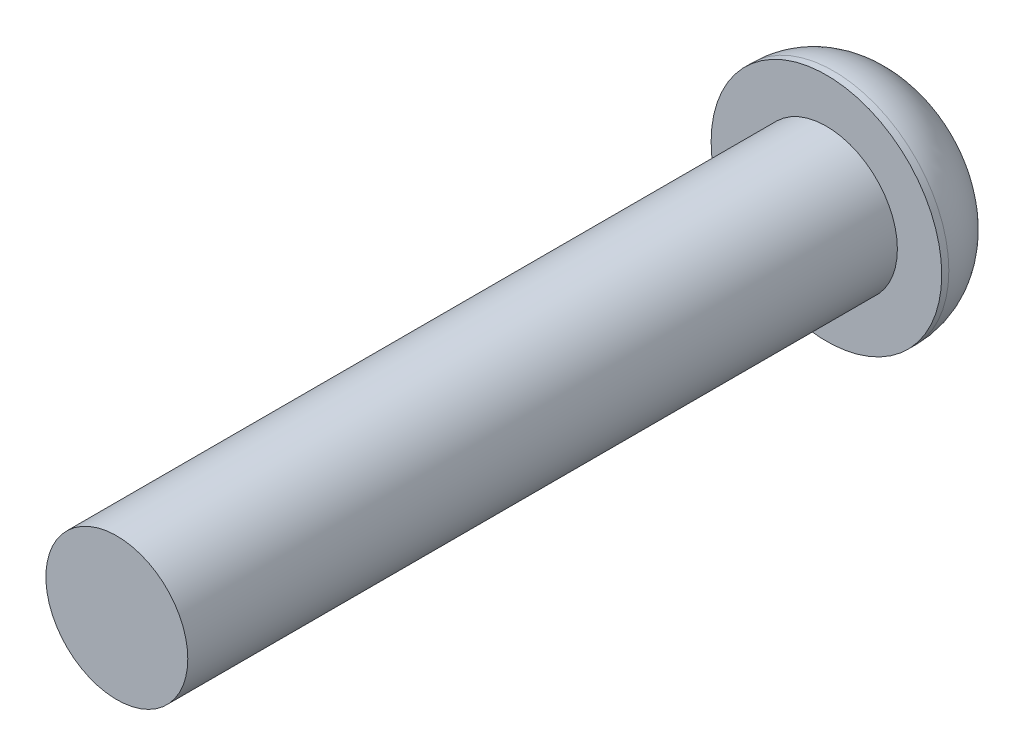
from build123d import *

# Parameters (mm, degrees)
SKETCH_1_R          = 2
EXTRUDE_1_DEPTH     = 20
SKETCH_2_R          = 3.25
EXTRUDE_2_DEPTH     = 2.2
FILLET_1_R          = 2
CUT_EXTRUDE_1_DEPTH = 0.5


with BuildPart() as part:
    # 草图1 → 凸台-拉伸1 (new body)
    with BuildSketch(Plane.XY):
        Circle(SKETCH_1_R)
    extrude(amount=EXTRUDE_1_DEPTH)

    # 草图2 → 凸台-拉伸2 (add)
    with BuildSketch(Plane(origin=(0, 0, 0), x_dir=(-1, 0, 0), z_dir=(0, 0, -1))):
        Circle(SKETCH_2_R)
    extrude(amount=EXTRUDE_2_DEPTH)

    # 圆角1
    fillet_1_edges = [part.edges().sort_by_distance(p)[0] for p in [
        (3.25, 0, -2.2),
    ]]
    fillet(fillet_1_edges, radius=FILLET_1_R)

    # 草图3 → 切除-拉伸1 (cut)
    with BuildSketch(Plane(origin=(0, 0, -2.2), x_dir=(-1, 0, 0), z_dir=(0, 0, -1))):
        Polygon((3.239974874, 0.25), (3.239974874, -0.25), (0.25, -0.25), (0.25, -3.239974874), (-0.25, -3.239974874), (-0.25, -0.25), (-3.239974874, -0.25), (-3.239974874, 0.25), (-0.25, 0.25), (-0.25, 3.239974874), (0.25, 3.239974874), (0.25, 0.25), align=None)
    extrude(amount=-CUT_EXTRUDE_1_DEPTH, mode=Mode.SUBTRACT)


solid = part.part
